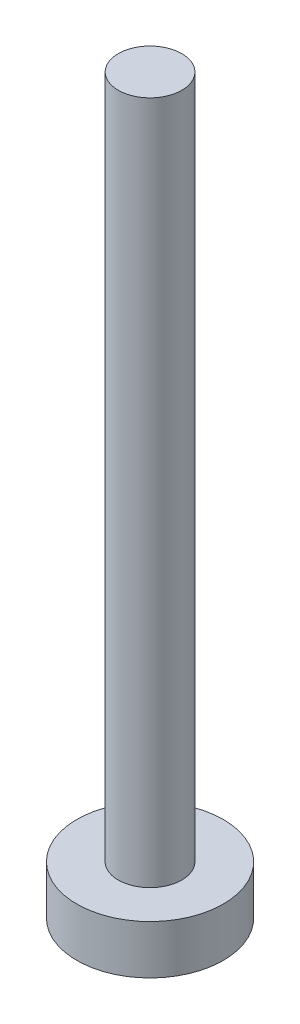
from build123d import *

# Parameters (mm, degrees)
SKETCH1_R           = 0.65
BOSS_EXTRUDE1_DEPTH = 14
SKETCH2_R           = 1.5
BOSS_EXTRUDE2_DEPTH = 1


with BuildPart() as part:
    # Sketch1 → Boss-Extrude1 (new body)
    with BuildSketch(Plane(origin=(0, 0, 0), x_dir=(1, 0, 0), z_dir=(0, 1, 0))):
        with Locations(Location((0, 0, 0), (0, 0, 270))):
            Circle(SKETCH1_R)
    extrude(amount=BOSS_EXTRUDE1_DEPTH)

    # Sketch2 → Boss-Extrude2 (add)
    with BuildSketch(Plane.XZ):
        with Locations(Location((0, 0, 0), (0, 0, 270))):
            Circle(SKETCH2_R)
    extrude(amount=BOSS_EXTRUDE2_DEPTH)


solid = part.part
